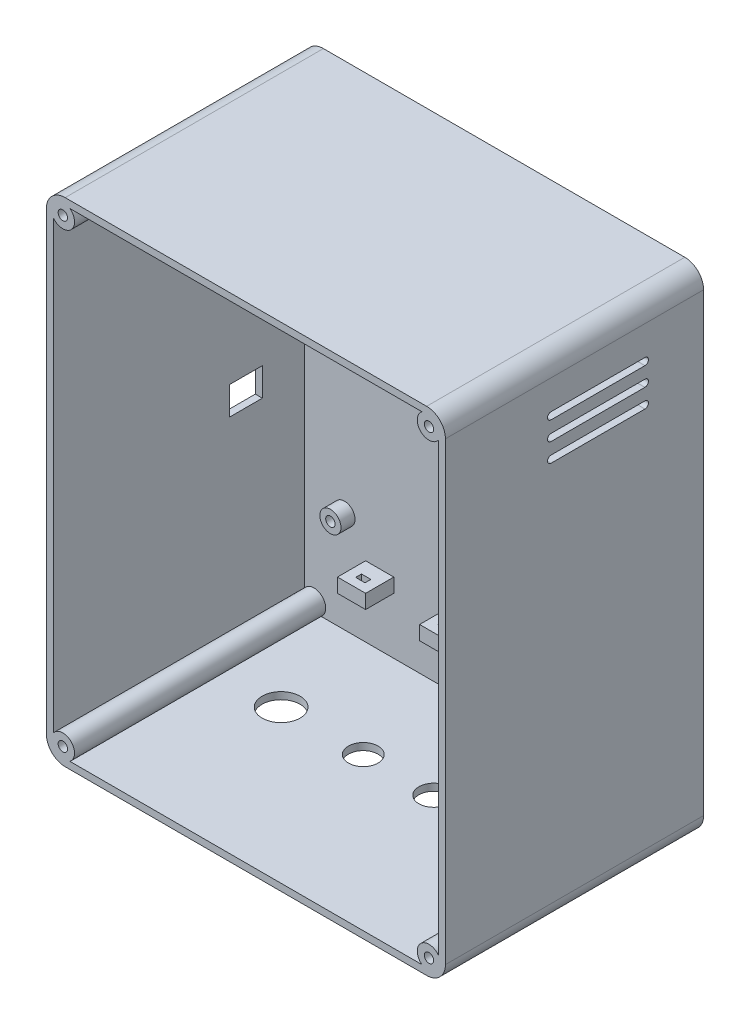
from build123d import *

# Parameters (mm, degrees)
BLOCK_DEPTH                    = 110
SHELL1_T                       = -3
SKETCH2_R                      = 5
CORNER_COLUMNS_DEPTH           = 110
SKETCH3_R                      = 2
FRONT_PANEL_INSERT_HOLES_DEPTH = 7
SKETCH4_R                      = 4.5
PLATE_BOSSES_DEPTH             = 6
SKETCH5_R                      = 2
PLATE_INSERT_HOLES_DEPTH       = 7
SKETCH6_R                      = 8.1
SKETCH6_R_2                    = 6.3
CABLE_GLAND_HOLES_DEPTH        = 4
SKETCH7_W                      = 12
SKETCH7_H                      = 6
CABLE_TIE_BARS_DEPTH           = 12
SKETCH8_W                      = 4
SKETCH8_H                      = 2.5
CABLE_TIE_SLOTS_DEPTH          = 6.02
SKETCH9_W                      = 14
SKETCH9_H                      = 12
USB_ACCESS_DEPTH               = 4
VENTS_LEFT_DEPTH               = 4
VENTS_START                    = -4
VENTS_RIGHT_DEPTH              = 4
SKETCH12_R                     = 4.75
KEYHOLE_HEADS_DEPTH            = 4
KEYHOLE_SLOTS_DEPTH            = 4


with BuildPart() as part:
    # Sketch1 → Block (new body)
    with BuildSketch(Plane.XY):
        with BuildLine():
            Line((-77, 0), (77, 0))
            ThreePointArc((77, 0), (82.656854249, 2.343145751), (85, 8))
            Line((85, 8), (85, 202))
            ThreePointArc((85, 202), (82.656854249, 207.656854249), (77, 210))
            Line((77, 210), (-77, 210))
            ThreePointArc((-77, 210), (-82.656854249, 207.656854249), (-85, 202))
            Line((-85, 202), (-85, 8))
            ThreePointArc((-85, 8), (-82.656854249, 2.343145751), (-77, 0))
        make_face()
    extrude(amount=BLOCK_DEPTH)

    # Shell1
    shell1_openings = [part.faces().sort_by_distance(p)[0] for p in [
        (0, 105, 110),
    ]]
    offset(amount=SHELL1_T, openings=shell1_openings, kind=Kind.INTERSECTION)

    # Sketch2 → Corner columns (add)
    with BuildSketch(Plane.XY):
        with Locations((-78, 7)):
            Circle(SKETCH2_R)
        with Locations((78, 7)):
            Circle(SKETCH2_R)
        with Locations((-78, 203)):
            Circle(SKETCH2_R)
        with Locations((78, 203)):
            Circle(SKETCH2_R)
    extrude(amount=CORNER_COLUMNS_DEPTH)

    # Sketch3 → Front panel insert holes (cut)
    with BuildSketch(Plane.XY.offset(110)):
        with Locations((-78, 7)):
            Circle(SKETCH3_R)
        with Locations((78, 7)):
            Circle(SKETCH3_R)
        with Locations((-78, 203)):
            Circle(SKETCH3_R)
        with Locations((78, 203)):
            Circle(SKETCH3_R)
    extrude(amount=-FRONT_PANEL_INSERT_HOLES_DEPTH, mode=Mode.SUBTRACT)

    # Sketch4 → Plate bosses (add)
    with BuildSketch(Plane.XY.offset(3)):
        with Locations((-65, 46)):
            Circle(SKETCH4_R)
        with Locations((65, 46)):
            Circle(SKETCH4_R)
        with Locations((-65, 190)):
            Circle(SKETCH4_R)
        with Locations((65, 190)):
            Circle(SKETCH4_R)
    extrude(amount=PLATE_BOSSES_DEPTH)

    # Sketch5 → Plate insert holes (cut)
    with BuildSketch(Plane.XY.offset(9)):
        with Locations((-65, 46)):
            Circle(SKETCH5_R)
        with Locations((65, 46)):
            Circle(SKETCH5_R)
        with Locations((-65, 190)):
            Circle(SKETCH5_R)
        with Locations((65, 190)):
            Circle(SKETCH5_R)
    extrude(amount=-PLATE_INSERT_HOLES_DEPTH, mode=Mode.SUBTRACT)

    # Sketch6 → Cable gland holes (cut)
    with BuildSketch(Plane(origin=(0, 0, 0), x_dir=(1, 0, 0), z_dir=(0, 1, 0))):
        with Locations(Location((-50, -45, 0), (0, 0, 270))):
            Circle(SKETCH6_R)
        with Locations(Location((-15, -45, 0), (0, 0, 270))):
            Circle(SKETCH6_R_2)
        with Locations(Location((15, -45, 0), (0, 0, 270))):
            Circle(SKETCH6_R_2)
        with Locations(Location((50, -45, 0), (0, 0, 270))):
            Circle(SKETCH6_R_2)
    extrude(amount=CABLE_GLAND_HOLES_DEPTH, mode=Mode.SUBTRACT)

    # Sketch7 → Cable tie bars (add)
    with BuildSketch(Plane.XY.offset(3)):
        with Locations((-50, 30)):
            Rectangle(SKETCH7_W, SKETCH7_H)
        with Locations((-15, 30)):
            Rectangle(SKETCH7_W, SKETCH7_H)
        with Locations((15, 30)):
            Rectangle(SKETCH7_W, SKETCH7_H)
        with Locations((50, 30)):
            Rectangle(SKETCH7_W, SKETCH7_H)
    extrude(amount=CABLE_TIE_BARS_DEPTH)

    # Sketch8 → Cable tie slots (cut)
    with BuildSketch(Plane(origin=(0, 26.99, 0), x_dir=(1, 0, 0), z_dir=(0, 1, 0))):
        with Locations((-50, -10)):
            Rectangle(SKETCH8_W, SKETCH8_H)
        with Locations((-15, -10)):
            Rectangle(SKETCH8_W, SKETCH8_H)
        with Locations((15, -10)):
            Rectangle(SKETCH8_W, SKETCH8_H)
        with Locations((50, -10)):
            Rectangle(SKETCH8_W, SKETCH8_H)
    extrude(amount=CABLE_TIE_SLOTS_DEPTH, mode=Mode.SUBTRACT)

    # Sketch9 → USB access (cut)
    with BuildSketch(Plane(origin=(-85, 0, 0), x_dir=(0, 0, -1), z_dir=(1, 0, 0))):
        with Locations((-28, 95)):
            Rectangle(SKETCH9_W, SKETCH9_H)
    extrude(amount=USB_ACCESS_DEPTH, mode=Mode.SUBTRACT)

    # Sketch10 → Vents left (cut)
    with BuildSketch(Plane(origin=(-85, 0, 0), x_dir=(0, 0, -1), z_dir=(1, 0, 0))):
        with BuildLine():
            Line((-25, 170.5), (-65, 170.5))
            ThreePointArc((-65, 170.5), (-66.5, 172), (-65, 173.5))
            Line((-65, 173.5), (-25, 173.5))
            ThreePointArc((-25, 173.5), (-23.5, 172), (-25, 170.5))
        make_face()
        with BuildLine():
            Line((-25, 178.5), (-65, 178.5))
            ThreePointArc((-65, 178.5), (-66.5, 180), (-65, 181.5))
            Line((-65, 181.5), (-25, 181.5))
            ThreePointArc((-25, 181.5), (-23.5, 180), (-25, 178.5))
        make_face()
        with BuildLine():
            Line((-25, 186.5), (-65, 186.5))
            ThreePointArc((-65, 186.5), (-66.5, 188), (-65, 189.5))
            Line((-65, 189.5), (-25, 189.5))
            ThreePointArc((-25, 189.5), (-23.5, 188), (-25, 186.5))
        make_face()
    extrude(amount=VENTS_LEFT_DEPTH, mode=Mode.SUBTRACT)

    # Sketch11 → Vents right (cut)
    with BuildSketch(Plane(origin=(85, 0, 0), x_dir=(0, 0, -1), z_dir=(1, 0, 0)).offset(VENTS_START)):
        with BuildLine():
            Line((-25, 170.5), (-65, 170.5))
            ThreePointArc((-65, 170.5), (-66.5, 172), (-65, 173.5))
            Line((-65, 173.5), (-25, 173.5))
            ThreePointArc((-25, 173.5), (-23.5, 172), (-25, 170.5))
        make_face()
        with BuildLine():
            Line((-25, 178.5), (-65, 178.5))
            ThreePointArc((-65, 178.5), (-66.5, 180), (-65, 181.5))
            Line((-65, 181.5), (-25, 181.5))
            ThreePointArc((-25, 181.5), (-23.5, 180), (-25, 178.5))
        make_face()
        with BuildLine():
            Line((-25, 186.5), (-65, 186.5))
            ThreePointArc((-65, 186.5), (-66.5, 188), (-65, 189.5))
            Line((-65, 189.5), (-25, 189.5))
            ThreePointArc((-25, 189.5), (-23.5, 188), (-25, 186.5))
        make_face()
    extrude(amount=VENTS_RIGHT_DEPTH, mode=Mode.SUBTRACT)

    # Sketch12 → Keyhole heads (cut)
    with BuildSketch(Plane.XY):
        with Locations((-45, 165)):
            Circle(SKETCH12_R)
        with Locations((45, 165)):
            Circle(SKETCH12_R)
    extrude(amount=KEYHOLE_HEADS_DEPTH, mode=Mode.SUBTRACT)

    # Sketch13 → Keyhole slots (cut)
    with BuildSketch(Plane.XY):
        with BuildLine():
            Line((-47.4, 165), (-47.4, 176))
            ThreePointArc((-47.4, 176), (-45, 178.4), (-42.6, 176))
            Line((-42.6, 176), (-42.6, 165))
            ThreePointArc((-42.6, 165), (-45, 162.6), (-47.4, 165))
        make_face()
        with BuildLine():
            Line((42.6, 165), (42.6, 176))
            ThreePointArc((42.6, 176), (45, 178.4), (47.4, 176))
            Line((47.4, 176), (47.4, 165))
            ThreePointArc((47.4, 165), (45, 162.6), (42.6, 165))
        make_face()
    extrude(amount=KEYHOLE_SLOTS_DEPTH, mode=Mode.SUBTRACT)


solid = part.part
